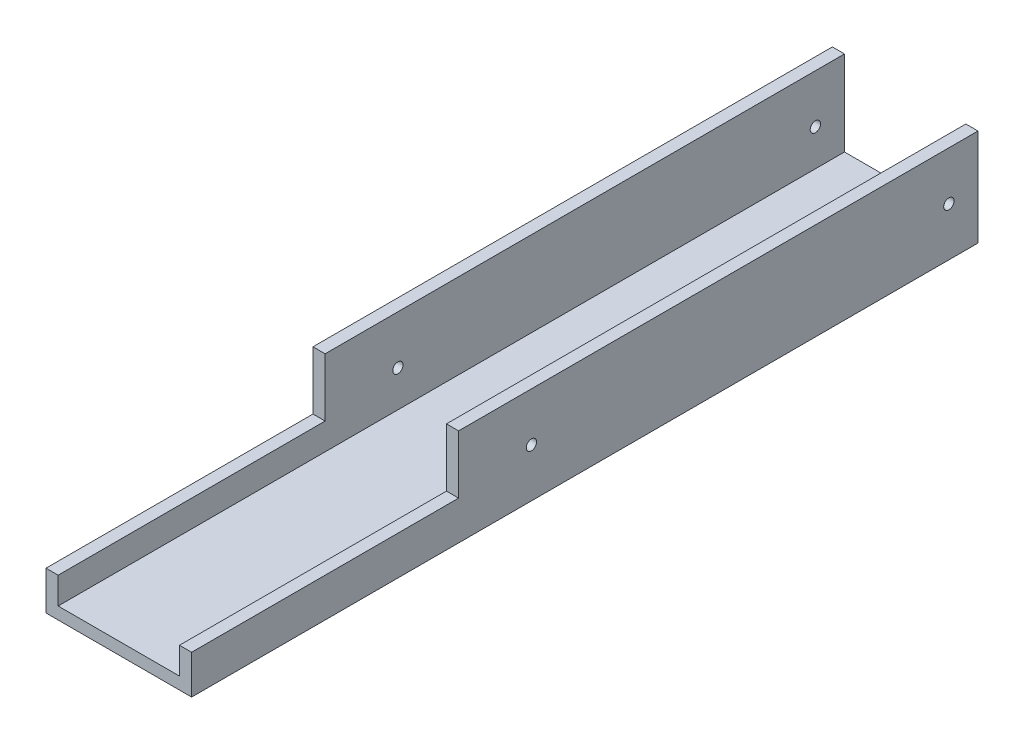
from build123d import *

# Parameters (mm, degrees)
BOSS_EXTRUDE2_DEPTH     = 609.6
CUT_EXTRUDE1_DEPTH      = 1013.46
F_6_32_TAPPED_HOLE1_D   = 2.7051
F_6_32_TAPPED_HOLE2_D   = 2.7051
CUT_EXTRUDE4_DEPTH      = 611.921484317
CUT_EXTRUDE4_DEPTH_BACK = 611.921484317
SKETCH13_W              = 69.85
SKETCH13_H              = 15.24


with BuildPart() as part:
    # Sketch3 → Boss-Extrude2 (new, symmetric)
    with BuildSketch(Plane.XY):
        Polygon((-19.05, 12.7), (-19.05, -12.7), (19.05, -12.7), (19.05, 12.7), (15.875, 12.7), (15.875, -9.525), (-15.875, -9.525), (-15.875, 12.7), align=None)
    extrude(amount=BOSS_EXTRUDE2_DEPTH, both=True)

    # Sketch5 → Cut-Extrude1 (cut)
    with BuildSketch(Plane.XY.offset(609.6)):
        Polygon((-19.05, 12.7), (-15.875, 12.7), (-15.875, -9.525), (15.875, -9.525), (15.875, 12.7), (19.05, 12.7), (19.05, -12.7), (-19.05, -12.7), align=None)
    extrude(amount=-CUT_EXTRUDE1_DEPTH, mode=Mode.SUBTRACT)

    # #6-32 Tapped Hole1 (through all)
    with Locations(Plane.ZY.offset(19.05)):
        with Locations((-601.98, 0)):
            Hole(F_6_32_TAPPED_HOLE1_D / 2)

    # #6-32 Tapped Hole2 (through all)
    with Locations(Plane.ZY.offset(19.05)):
        with Locations((-492.76, 0)):
            Hole(F_6_32_TAPPED_HOLE2_D / 2)

    # Sketch13 → Cut-Extrude4 (cut, two sides: drawn at the far end of the back side and taken through both)
    with BuildSketch(Plane.ZY.offset(19.05).offset(-CUT_EXTRUDE4_DEPTH_BACK)):
        with Locations((-438.785, 5.08)):
            Rectangle(SKETCH13_W, SKETCH13_H)
    extrude(amount=CUT_EXTRUDE4_DEPTH + CUT_EXTRUDE4_DEPTH_BACK, mode=Mode.SUBTRACT)


solid = part.part
